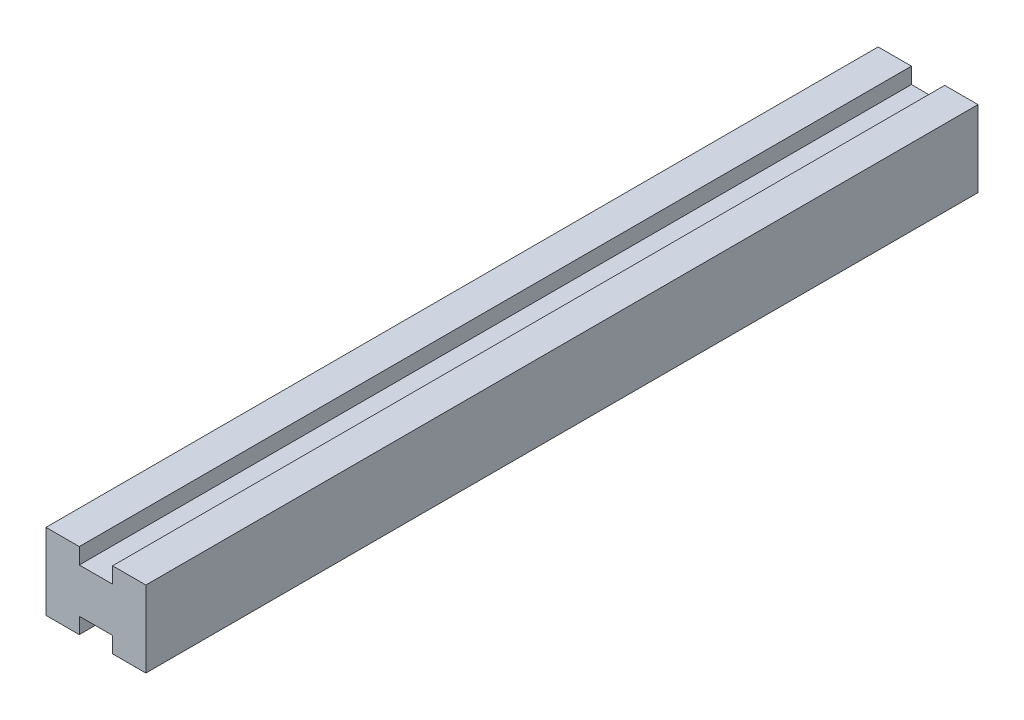
from build123d import *

# Parameters (mm, degrees)
BOSS_EXTRUDE1_DEPTH = 60


with BuildPart() as part:
    # Sketch1 → Boss-Extrude1 (new body)
    with BuildSketch(Plane.XY):
        Polygon((-1.2, 2.75), (-3.6, 2.75), (-3.6, -2.75), (-1.2, -2.75), (-1.2, -1.6), (1.2, -1.6), (1.2, -2.75), (3.6, -2.75), (3.6, 2.75), (1.2, 2.75), (1.2, 1.6), (-1.2, 1.6), align=None)
    extrude(amount=BOSS_EXTRUDE1_DEPTH)


solid = part.part
